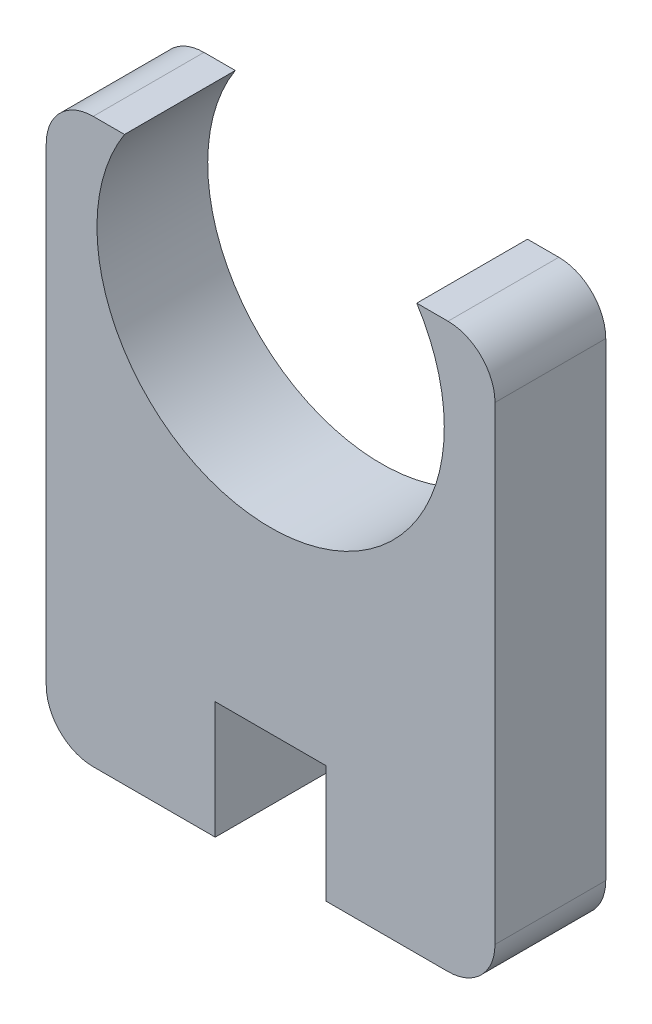
from build123d import *

# Parameters (mm, degrees)
BOSS_EXTRUDE1_DEPTH = 2.9972
FILLET1_R           = 1.27


with BuildPart() as part:
    # Sketch1 → Boss-Extrude1 (new body)
    with BuildSketch(Plane.XY):
        with BuildLine():
            Line((0, 0), (0, 15.24))
            Line((0, 15.24), (2.117246866, 15.24))
            ThreePointArc((2.117246866, 15.24), (6.0706, 8.001), (10.023953134, 15.24))
            Line((10.023953134, 15.24), (12.1412, 15.24))
            Line((12.1412, 15.24), (12.1412, 0))
            Line((12.1412, 0), (7.5692, 0))
            Line((7.5692, 0), (7.5692, 3.175))
            Line((7.5692, 3.175), (4.572, 3.175))
            Line((4.572, 3.175), (4.572, 0))
            Line((4.572, 0), (0, 0))
        make_face()
    extrude(amount=BOSS_EXTRUDE1_DEPTH)

    # Fillet1
    fillet1_edges = [part.edges().sort_by_distance(p)[0] for p in [
        (0, 0, 1.4986),
        (0, 15.24, 1.4986),
        (12.1412, 15.24, 1.4986),
        (12.1412, 0, 1.4986),
    ]]
    fillet(fillet1_edges, radius=FILLET1_R)


solid = part.part
